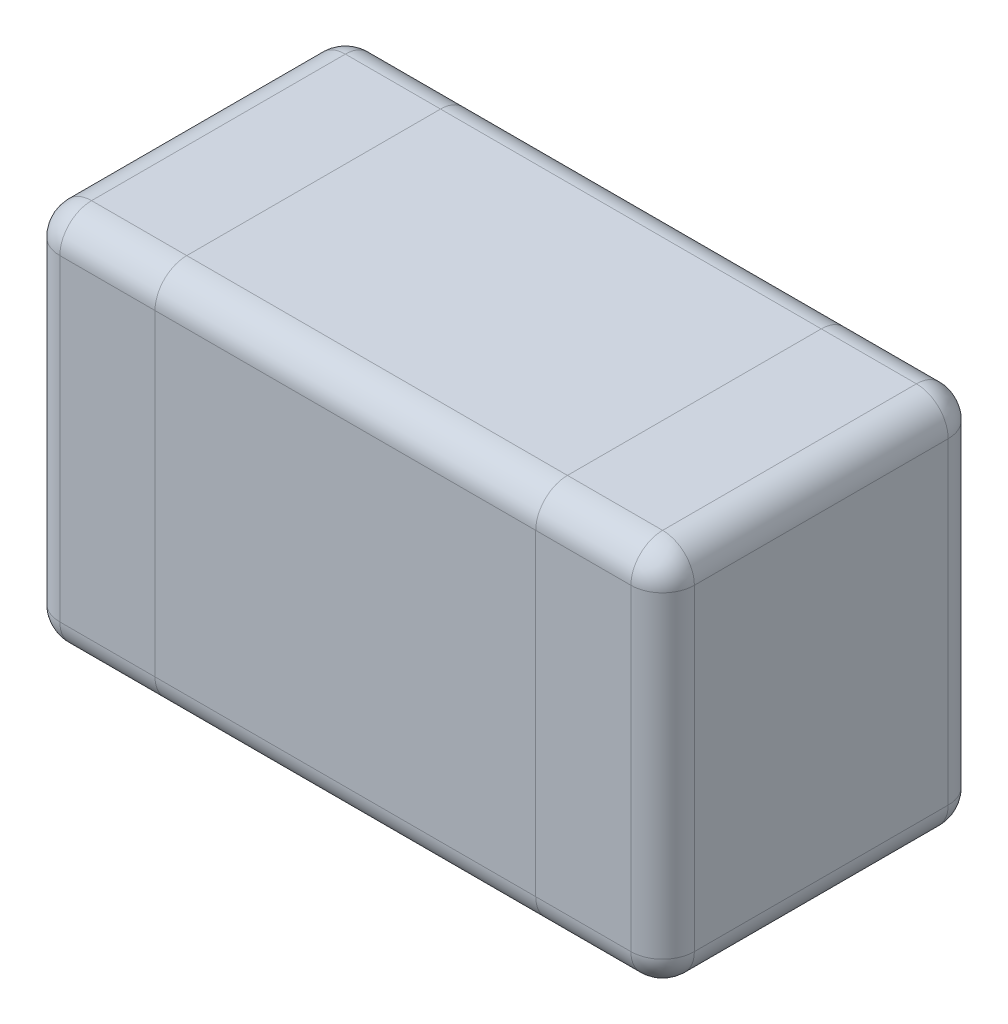
from build123d import *

# Parameters (mm, degrees)
SKETCH1_W      = 1
SKETCH1_H      = 0.5
EXTRUDE1_DEPTH = 0.6
FILLET1_R      = 0.05


with BuildPart() as part:
    # Sketch1 → Extrude1 (new body)
    with BuildSketch(Plane(origin=(0, 0, 0), x_dir=(1, 0, 0), z_dir=(0, 1, 0))):
        Rectangle(SKETCH1_W, SKETCH1_H)
    extrude(amount=EXTRUDE1_DEPTH)

    # Fillet1
    fillet1_edges = [part.edges().sort_by_distance(p)[0] for p in [
        (-0.5, 0.6, 0),
        (0, 0.6, 0.25),
        (0.5, 0.6, 0),
        (0, 0, 0.25),
        (-0.5, 0, 0),
        (0, 0, -0.25),
        (0.5, 0, 0),
        (0, 0.6, -0.25),
        (0.5, 0.3, 0.25),
        (-0.5, 0.3, 0.25),
        (-0.5, 0.3, -0.25),
        (0.5, 0.3, -0.25),
    ]]
    fillet(fillet1_edges, radius=FILLET1_R)


solid = part.part
